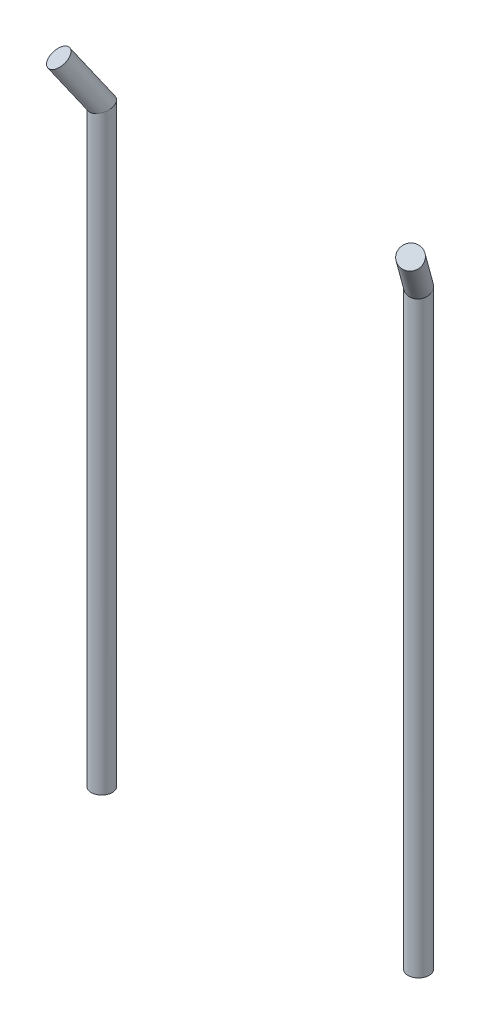
from build123d import *

# Parameters (mm, degrees)
SWEEP_4_PROFILE_R = 5
SWEEP_5_PROFILE_R = 5


with BuildPart() as part:
    # 扫描4: sweep along a path in 草图90
    with BuildLine(Plane(origin=(98.045795282, 0, -71.371502155), x_dir=(-0.5885247359201105, 0, -0.8084792113654897), z_dir=(0.8084792113654897, 0, -0.5885247359201105))) as sweep_4_path:
        Line((-105.521590911, 304.145672377), (-88.278710388, 280))
        Line((-88.278710388, 280), (-88.278710388, 0))
    # 扫描4 profile (on start of the path) → 扫描4 (sweep)
    with BuildSketch(Plane(origin=(160.147861706, 304.145672377, 13.940510447), x_dir=(0, 0.5000000000000007, -0.8660254037844384), z_dir=(-0.34202014332567265, -0.8137976813493721, -0.4698463103929541))):
        Circle(SWEEP_4_PROFILE_R)
    sweep(path=sweep_4_path.line, transition=Transition.RIGHT)


with BuildPart() as body_2:
    # 扫描5: sweep along a path in 草图91
    with BuildLine(Plane(origin=(0, 0, 0), x_dir=(0.5885247359201103, 0, -0.80847921136549), z_dir=(0.8084792113654898, 0, 0.5885247359201102))) as sweep_5_path:
        Line((0, 0), (0, 280))
        Line((0, 280), (-14.573448455, 300.407594389))
    # 扫描5 profile (on start of the path) → 扫描5 (sweep)
    with BuildSketch(Plane.ZX):
        Circle(SWEEP_5_PROFILE_R)
    sweep(path=sweep_5_path.line, transition=Transition.RIGHT)


solid = Compound([part.part, body_2.part])
